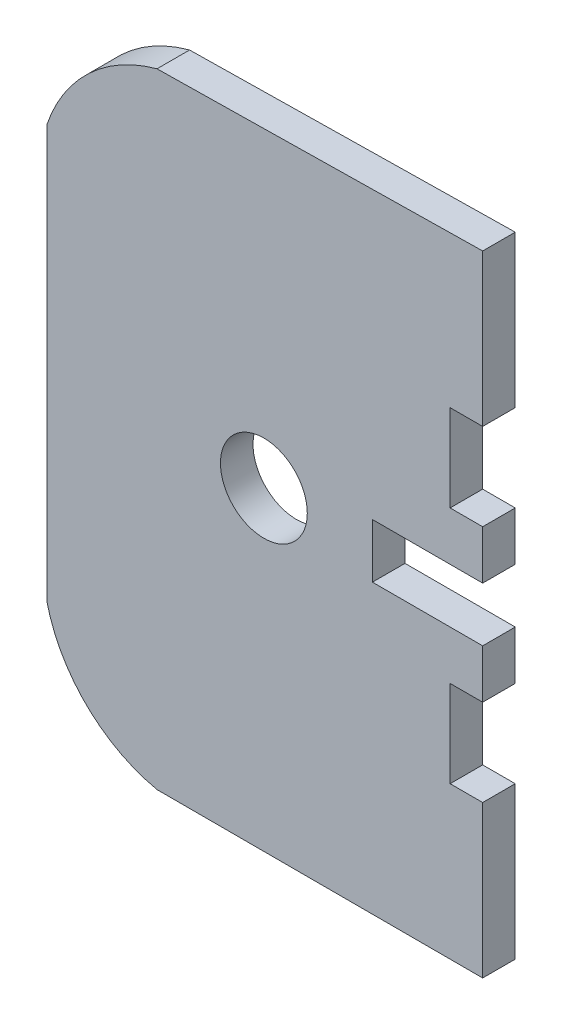
from build123d import *

# Parameters (mm, degrees)
SKETCH1_R           = 4
BOSS_EXTRUDE1_DEPTH = 3


with BuildPart() as part:
    # Sketch1 → Boss-Extrude1 (new body)
    with BuildSketch(Plane.XY):
        with BuildLine():
            Line((104.119192453, 179.407061364), (134.119192453, 179.874374377))
            Line((134.119192453, 179.874374377), (134.119192453, 165.874374377))
            Line((134.119192453, 165.874374377), (131.119192453, 165.874374377))
            Line((131.119192453, 165.874374377), (131.119192453, 157.874374377))
            Line((131.119192453, 157.874374377), (134.119192453, 157.874374377))
            Line((134.119192453, 157.874374377), (134.119192453, 153.374336284))
            Line((134.119192453, 153.374336284), (123.963204023, 153.374336284))
            Line((123.963204023, 153.374336284), (123.963204023, 148.374336284))
            Line((123.963204023, 148.374336284), (134.119192453, 148.374336284))
            Line((134.119192453, 148.374336284), (134.119192453, 143.874374377))
            Line((134.119192453, 143.874374377), (131.119192453, 143.874374377))
            Line((131.119192453, 143.874374377), (131.119192453, 135.874374377))
            Line((131.119192453, 135.874374377), (134.119192453, 135.874374377))
            Line((134.119192453, 135.874374377), (134.119192453, 121.874374377))
            Line((134.119192453, 121.874374377), (104.119206498, 121.903403691))
            ThreePointArc((104.119206498, 121.903403691), (97.58987401, 125.424418251), (93.963204023, 131.895661647))
            Line((93.963204023, 131.895661647), (93.963204023, 169.853170932))
            ThreePointArc((93.963204023, 169.853170932), (97.844114816, 175.902641249), (104.119192453, 179.407061364))
        make_face()
        with Locations((113.963204023, 150.874376287)):
            Circle(SKETCH1_R, mode=Mode.SUBTRACT)
    extrude(amount=BOSS_EXTRUDE1_DEPTH)


solid = part.part
